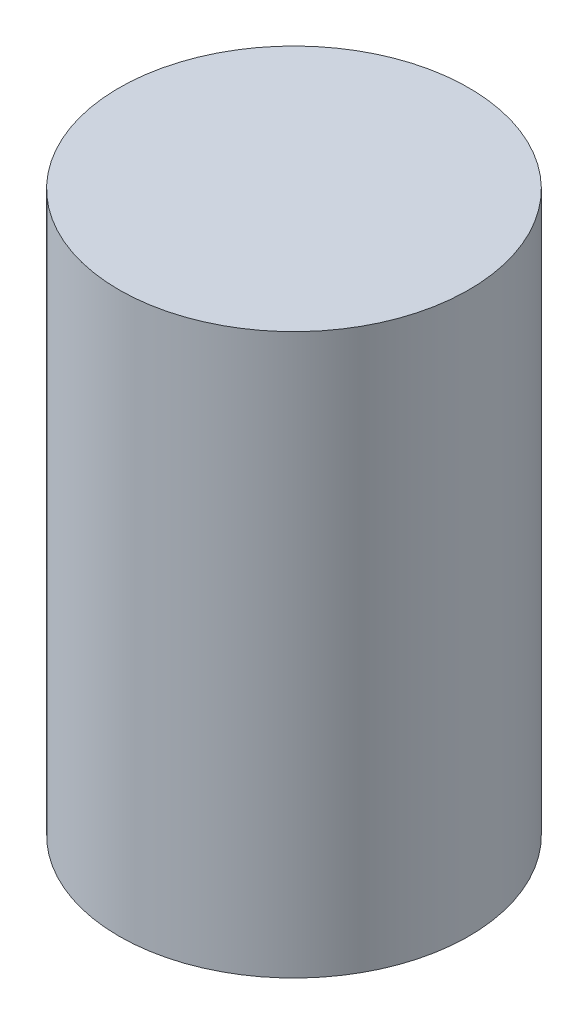
from build123d import *

# Parameters (mm, degrees)
SKETCH1_R           = 250
BOSS_EXTRUDE1_DEPTH = 800


with BuildPart() as part:
    # Sketch1 → Boss-Extrude1 (new body)
    with BuildSketch(Plane(origin=(0, 0, 0), x_dir=(1, 0, 0), z_dir=(0, 1, 0))):
        with Locations(Location((0, 0, 0), (0, 0, 270))):
            Circle(SKETCH1_R)
    extrude(amount=BOSS_EXTRUDE1_DEPTH)


solid = part.part
